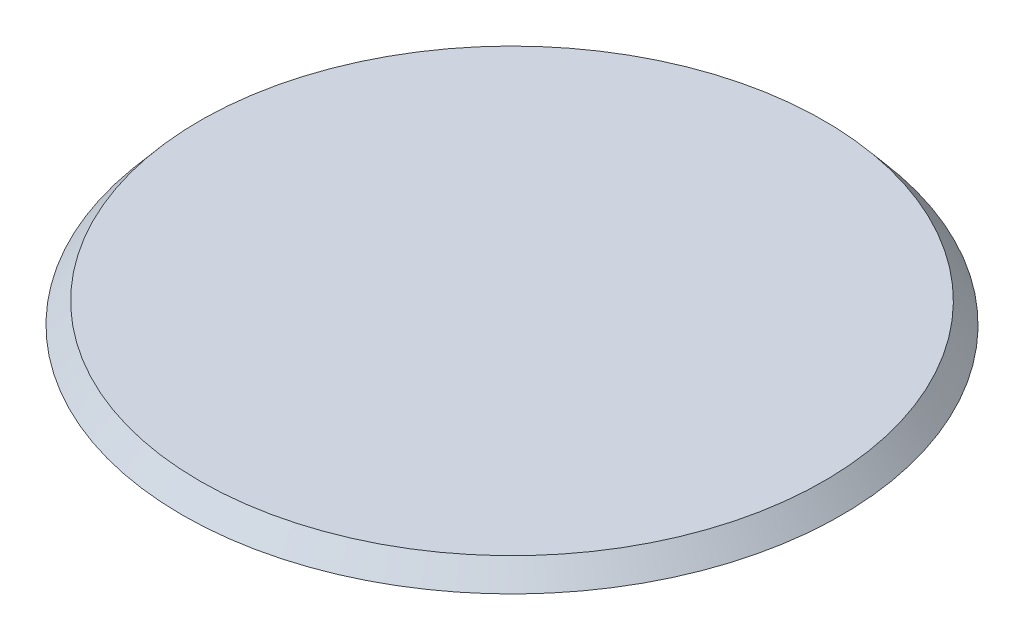
from build123d import *

# Parameters (mm, degrees)
SKETCH4_R           = 30
BOSS_EXTRUDE1_DEPTH = 2
BOSS_EXTRUDE1_DRAFT = 40


with BuildPart() as part:
    # Sketch4 → Boss-Extrude1 (with draft: the straight prism first)
    with BuildSketch(Plane(origin=(0, 0, 0), x_dir=(1, 0, 0), z_dir=(0, 1, 0))):
        Circle(SKETCH4_R)
    extrude(amount=-BOSS_EXTRUDE1_DEPTH)
    # Boss-Extrude1: the draft: its side faces are tilted about the plane it starts from
    boss_extrude1_sides = [part.faces().sort_by_distance(p)[0] for p in [
        (-30, -1, 0),
    ]]
    draft(boss_extrude1_sides, Plane(origin=(0, 0, 0), x_dir=(1, 0, 0), z_dir=(0, 1, 0)), BOSS_EXTRUDE1_DRAFT)


solid = part.part
